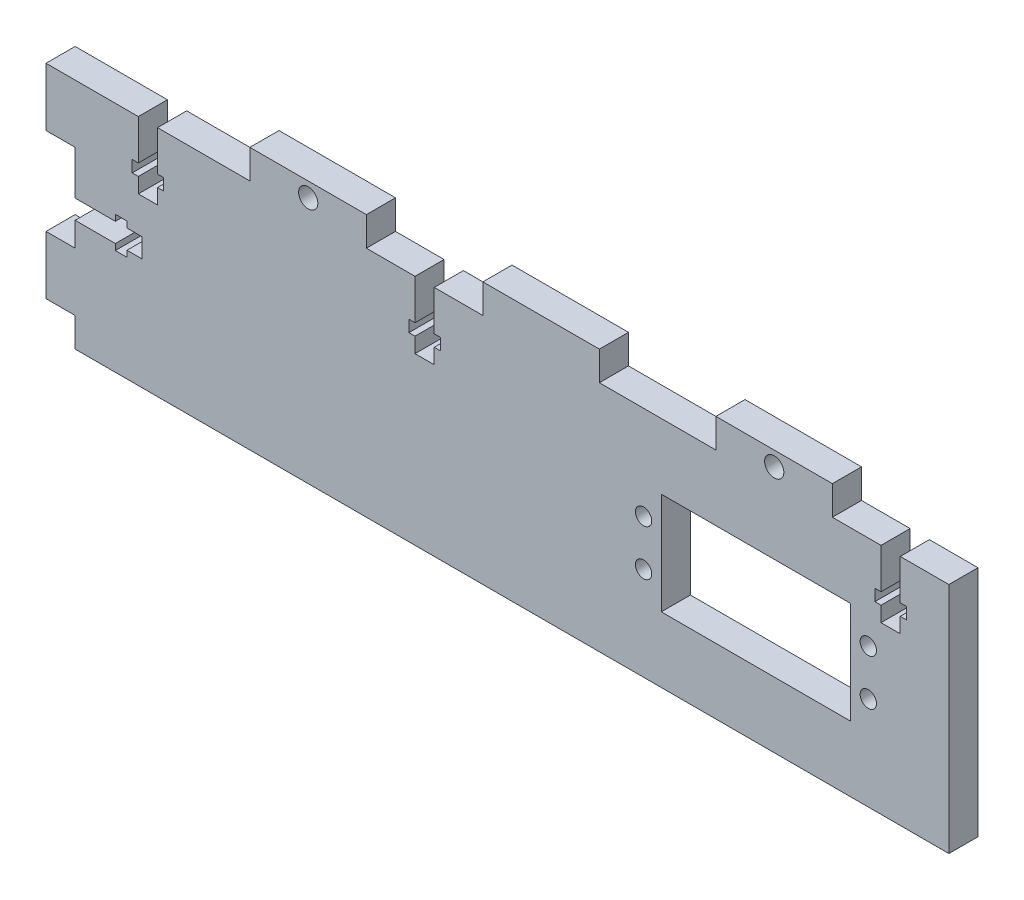
from build123d import *

# Parameters (mm, degrees)
SKETCH1_W           = 190.5
SKETCH1_H           = 50.8
BOSS_EXTRUDE1_DEPTH = 6.35
SKETCH2_W           = 41.275
SKETCH2_H           = 22.225
CUT_EXTRUDE1_DEPTH  = 151.724377554
SKETCH3_W           = 25.4
SKETCH3_H           = 6.35
BOSS_EXTRUDE2_DEPTH = 6.35
LPATTERN1_COUNT     = 3
LPATTERN1_PITCH     = 50.8
SKETCH4_W           = 6.35
SKETCH4_H           = 12.7
BOSS_EXTRUDE3_DEPTH = 6.35
LPATTERN2_COUNT     = 2
LPATTERN2_PITCH     = 31.75
CUT_EXTRUDE2_DEPTH  = 6.35
SKETCH6_R           = 2.0955
CUT_EXTRUDE3_DEPTH  = 159.133368044
CUT_EXTRUDE4_DEPTH  = 159.133368044
SKETCH8_R           = 1.778
CUT_EXTRUDE5_DEPTH  = 159.133368044


with BuildPart() as part:
    # Sketch1 → Boss-Extrude1 (new body)
    with BuildSketch(Plane.XY):
        with Locations((-53.183, 0)):
            Rectangle(SKETCH1_W, SKETCH1_H)
    extrude(amount=BOSS_EXTRUDE1_DEPTH)

    # Sketch2 → Cut-Extrude1 (cut, through all)
    with BuildSketch(Plane.XY.offset(6.35)):
        Rectangle(SKETCH2_W, SKETCH2_H)
    extrude(amount=-CUT_EXTRUDE1_DEPTH, mode=Mode.SUBTRACT)

    # Sketch3 → Boss-Extrude2 (add)
    with BuildSketch(Plane(origin=(0, 25.4, 0), x_dir=(1, 0, 0), z_dir=(0, 1, 0))):
        with Locations((3.967, -3.175)):
            Rectangle(SKETCH3_W, SKETCH3_H)
    boss_extrude2 = extrude(amount=BOSS_EXTRUDE2_DEPTH)

    # LPattern1: Boss-Extrude2 ×3
    with Locations(*[(-i * LPATTERN1_PITCH, 0, 0) for i in range(1, LPATTERN1_COUNT)]):
        add(boss_extrude2)

    # Sketch4 → Boss-Extrude3 (add)
    with BuildSketch(Plane.ZY.offset(148.433)):
        with Locations((3.175, 19.05)):
            Rectangle(SKETCH4_W, SKETCH4_H)
    boss_extrude3 = extrude(amount=BOSS_EXTRUDE3_DEPTH)

    # LPattern2: Boss-Extrude3 ×2
    with Locations(*[(0, -i * LPATTERN2_PITCH, 0) for i in range(1, LPATTERN2_COUNT)]):
        add(boss_extrude3)

    # Sketch5 → Cut-Extrude2 (cut)
    with BuildSketch(Plane.XY.offset(6.35)):
        Polygon((31.4625, 25.4), (27.2715, 25.4), (27.2715, 16.637), (25.938, 16.637), (25.938, 14.097), (27.2715, 14.097), (27.2715, 10.795), (31.4625, 10.795), (31.4625, 14.097), (32.796, 14.097), (32.796, 16.637), (31.4625, 16.637), align=None)
        Polygon((-70.1375, 25.4), (-74.3285, 25.4), (-74.3285, 16.637), (-75.662, 16.637), (-75.662, 14.097), (-74.3285, 14.097), (-74.3285, 10.795), (-70.1375, 10.795), (-70.1375, 14.097), (-68.804, 14.097), (-68.804, 16.637), (-70.1375, 16.637), align=None)
        Polygon((-130.4625, 25.4), (-134.6535, 25.4), (-134.6535, 16.637), (-135.987, 16.637), (-135.987, 14.097), (-134.6535, 14.097), (-134.6535, 10.795), (-130.4625, 10.795), (-130.4625, 14.097), (-129.129, 14.097), (-129.129, 16.637), (-130.4625, 16.637), align=None)
    extrude(amount=-CUT_EXTRUDE2_DEPTH, mode=Mode.SUBTRACT)

    # Sketch6 → Cut-Extrude3 (cut, through all)
    with BuildSketch(Plane(origin=(0, 0, 0), x_dir=(-1, 0, 0), z_dir=(0, 0, -1))):
        with Locations((-3.98760291, 28.575)):
            Circle(SKETCH6_R)
        with Locations((97.61239709, 28.575)):
            Circle(SKETCH6_R)
    extrude(amount=-CUT_EXTRUDE3_DEPTH, mode=Mode.SUBTRACT)

    # Sketch7 → Cut-Extrude4 (cut, through all)
    with BuildSketch(Plane.XY.offset(6.35)):
        Polygon((-148.433, 3.1115), (-148.433, -1.0795), (-139.67, -1.0795), (-139.67, -2.413), (-137.13, -2.413), (-137.13, -1.0795), (-133.828, -1.0795), (-133.828, 3.1115), (-137.13, 3.1115), (-137.13, 4.445), (-139.67, 4.445), (-139.67, 3.1115), align=None)
    extrude(amount=-CUT_EXTRUDE4_DEPTH, mode=Mode.SUBTRACT)

    # Sketch8 → Cut-Extrude5 (cut, through all)
    with BuildSketch(Plane(origin=(0, 0, 0), x_dir=(-1, 0, 0), z_dir=(0, 0, -1))):
        with Locations((24.5, -5)):
            Circle(SKETCH8_R)
        with Locations((24.5, 5)):
            Circle(SKETCH8_R)
        with Locations((-24.5, 5)):
            Circle(SKETCH8_R)
        with Locations((-24.5, -5)):
            Circle(SKETCH8_R)
    extrude(amount=-CUT_EXTRUDE5_DEPTH, mode=Mode.SUBTRACT)


solid = part.part
